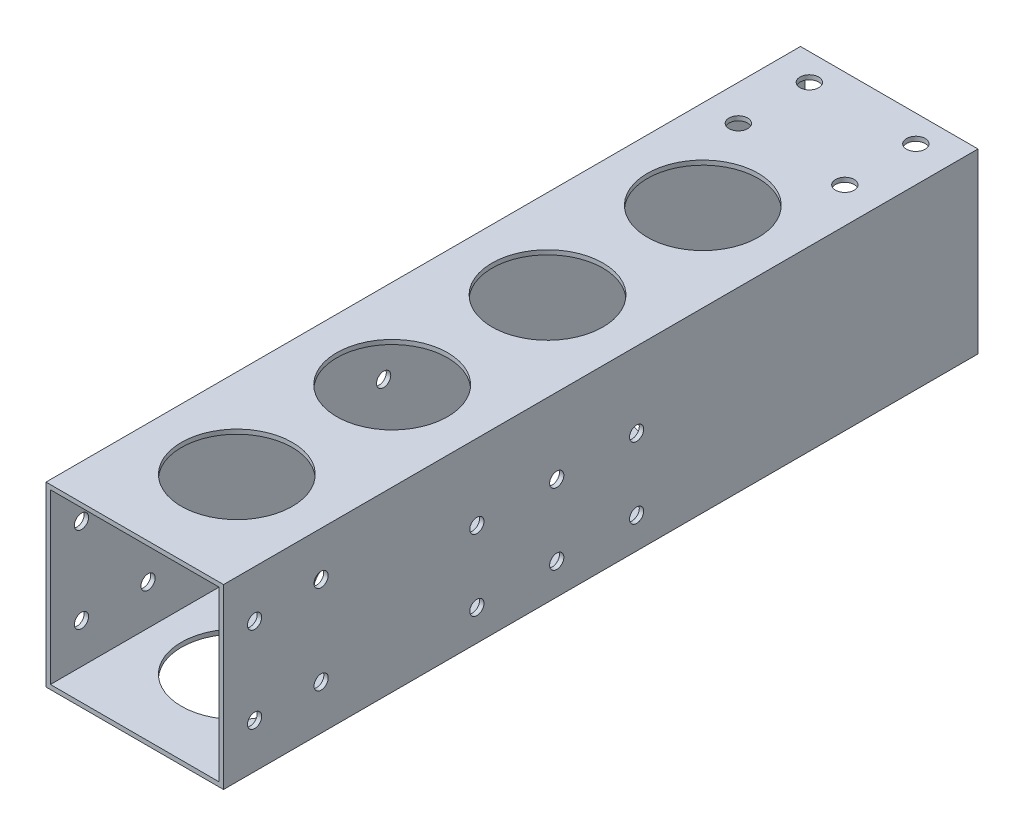
from build123d import *

# Parameters (mm, degrees)
SKETCH_1_W          = 40
SKETCH_1_H          = 40
SKETCH_1_W_2        = 38
SKETCH_1_H_2        = 38
EXTRUDE_1_DEPTH     = 170
SKETCH_2_R          = 2.1
CUT_EXTRUDE_1_DEPTH = 180.164728672
SKETCH_12_R         = 1.6
CUT_EXTRUDE_2_DEPTH = 180.164728672
SKETCH_13_R         = 1.6
CUT_EXTRUDE_3_DEPTH = 180.164728672
SKETCH_14_R         = 12.5
CUT_EXTRUDE_4_DEPTH = 180.164728672


with BuildPart() as part:
    # 草图1 → 凸台-拉伸1 (new body)
    with BuildSketch(Plane.XY):
        with Locations((20, 20)):
            Rectangle(SKETCH_1_W, SKETCH_1_H)
        with Locations((20, 20)):
            Rectangle(SKETCH_1_W_2, SKETCH_1_H_2, mode=Mode.SUBTRACT)
    extrude(amount=EXTRUDE_1_DEPTH)

    # 草图2 → 切除-拉伸1 (cut, through all)
    with BuildSketch(Plane.XZ):
        with Locations(Location((8, 6, 0), (0, 0, 270))):
            Circle(SKETCH_2_R)
        with Locations(Location((32, 22, 0), (0, 0, 270))):
            Circle(SKETCH_2_R)
        with Locations(Location((8, 22, 0), (0, 0, 270))):
            Circle(SKETCH_2_R)
        with Locations(Location((32, 6, 0), (0, 0, 270))):
            Circle(SKETCH_2_R)
    extrude(amount=-CUT_EXTRUDE_1_DEPTH, mode=Mode.SUBTRACT)

    # 草图12 → 切除-拉伸2 (cut, through all)
    with BuildSketch(Plane.ZY):
        with Locations((112.92, 7)):
            Circle(SKETCH_12_R)
        with Locations((94.92, 7)):
            Circle(SKETCH_12_R)
        with Locations((76.92, 7)):
            Circle(SKETCH_12_R)
        with Locations((94.92, 23)):
            Circle(SKETCH_12_R)
        with Locations((76.92, 23)):
            Circle(SKETCH_12_R)
        with Locations((112.92, 23)):
            Circle(SKETCH_12_R)
    extrude(amount=-CUT_EXTRUDE_2_DEPTH, mode=Mode.SUBTRACT)

    # 草图13 → 切除-拉伸3 (cut, through all)
    with BuildSketch(Plane.ZY):
        with Locations((163, 29.343081894)):
            Circle(SKETCH_13_R)
        with Locations((163, 10)):
            Circle(SKETCH_13_R)
        with Locations((148.01439139, 29.999994822)):
            Circle(SKETCH_13_R)
        with Locations((148, 10)):
            Circle(SKETCH_13_R)
    extrude(amount=-CUT_EXTRUDE_3_DEPTH, mode=Mode.SUBTRACT)

    # 草图14 → 切除-拉伸4 (cut, through all)
    with BuildSketch(Plane.XZ):
        with Locations(Location((20, 42, 0), (0, 0, 270))):
            Circle(SKETCH_14_R)
        with Locations(Location((20, 77, 0), (0, 0, 270))):
            Circle(SKETCH_14_R)
        with Locations(Location((20, 112, 0), (0, 0, 270))):
            Circle(SKETCH_14_R)
        with Locations(Location((20, 147, 0), (0, 0, 270))):
            Circle(SKETCH_14_R)
    extrude(amount=-CUT_EXTRUDE_4_DEPTH, mode=Mode.SUBTRACT)


solid = part.part
